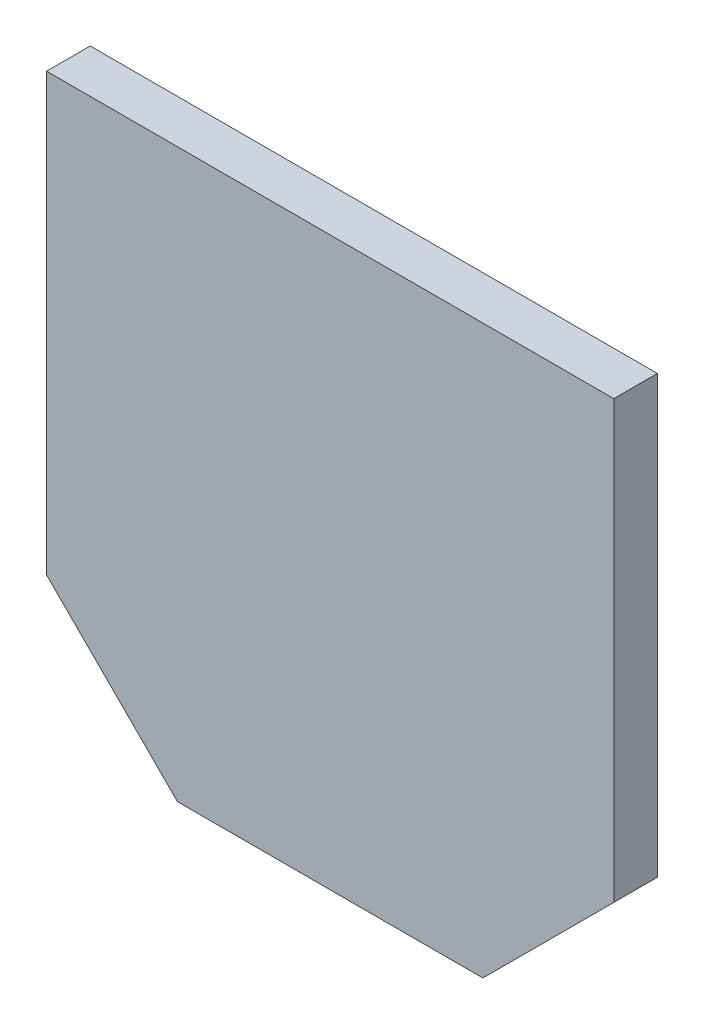
from build123d import *

# Parameters (mm, degrees)
SKETCH1_W           = 130
SKETCH1_H           = 130
BOSS_EXTRUDE2_DEPTH = 10
CHAMFER1_SIZE       = 30


with BuildPart() as part:
    # Sketch1 → Boss-Extrude2 (new body)
    with BuildSketch(Plane.XY):
        with Locations((65, 65)):
            Rectangle(SKETCH1_W, SKETCH1_H)
    extrude(amount=BOSS_EXTRUDE2_DEPTH)

    # Chamfer1
    chamfer1_edges = [part.edges().sort_by_distance(p)[0] for p in [
        (0, 0, 5),
        (130, 0, 5),
    ]]
    chamfer(chamfer1_edges, length=CHAMFER1_SIZE)


solid = part.part
